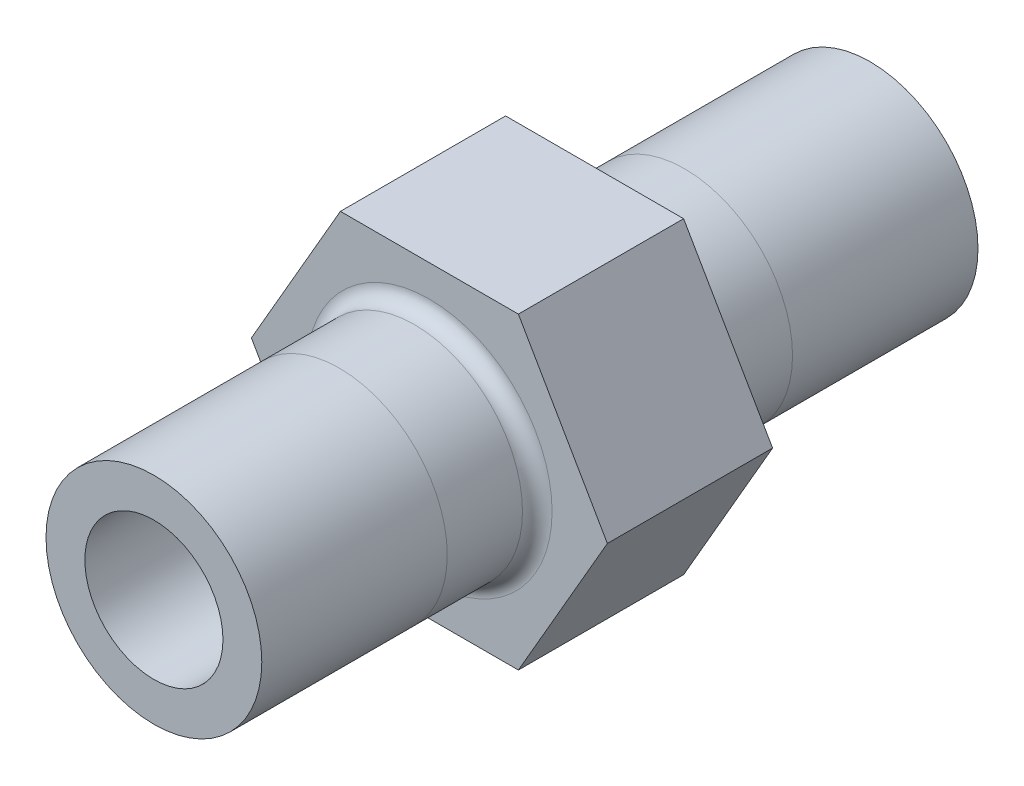
from build123d import *

# Parameters (mm, degrees)
SKETCH1_R           = 5.55625
BOSS_EXTRUDE1_DEPTH = 18.4404
BOSS_EXTRUDE2_DEPTH = 4.2545
SKETCH2_R           = 3.556
CUT_EXTRUDE1_DEPTH  = 39.822706284
FILLET1_R           = 0.762


with BuildPart() as part:
    # Sketch1 → Boss-Extrude1 (new, symmetric)
    with BuildSketch(Plane.XY):
        Circle(SKETCH1_R)
    extrude(amount=BOSS_EXTRUDE1_DEPTH, both=True)

    # Sketch3 → Boss-Extrude2 (add, symmetric)
    with BuildSketch(Plane.XY):
        Polygon((9.165435523, 0), (4.582717762, 7.9375), (-4.582717762, 7.9375), (-9.165435523, 0), (-4.582717762, -7.9375), (4.582717762, -7.9375), align=None)
    extrude(amount=BOSS_EXTRUDE2_DEPTH, both=True)

    # Sketch2 → Cut-Extrude1 (cut, through all)
    with BuildSketch(Plane.XY.offset(18.4404)):
        Circle(SKETCH2_R)
    extrude(amount=-CUT_EXTRUDE1_DEPTH, mode=Mode.SUBTRACT)

    # Fillet1
    fillet1_edges = [part.edges().sort_by_distance(p)[0] for p in [
        (-5.55625, 0, -4.2545),
        (-5.55625, 0, 4.2545),
    ]]
    fillet(fillet1_edges, radius=FILLET1_R)


solid = part.part
